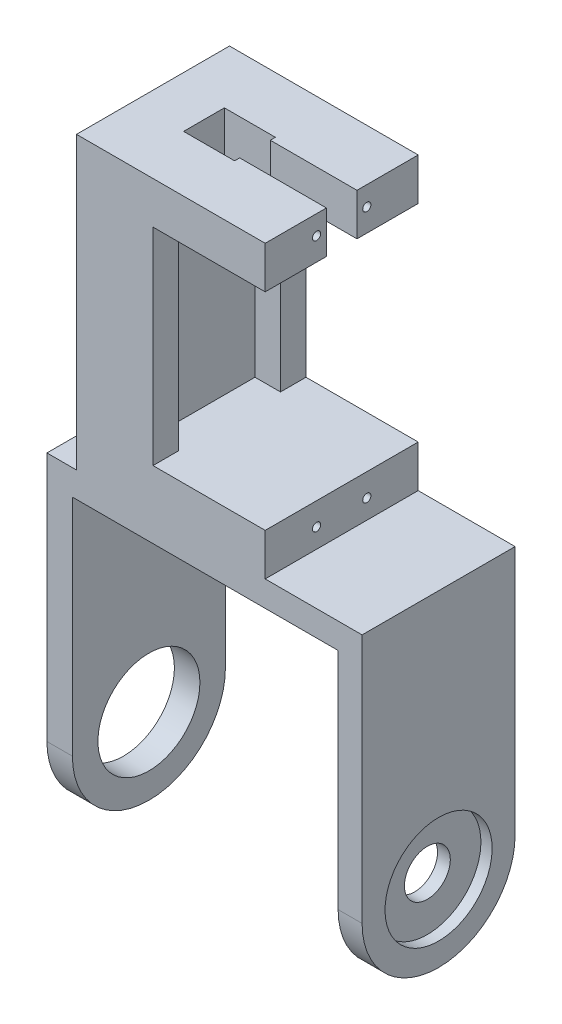
from build123d import *

# Parameters (mm, degrees)
ESQUISSE1_W               = 60.5
ESQUISSE1_H               = 64
BOSS_EXTRU_1_DEPTH        = 30
ESQUISSE2_R               = 4.5
ENL_V_MAT_EXTRU_1_DEPTH   = 32
ENL_V_MAT_EXTRU_2_REACH   = 55.283
ESQUISSE4_W               = 52.1
ESQUISSE4_H               = 83.557669167
ESQUISSE5_R               = 10.5
ENL_V_MAT_EXTRU_3_DEPTH   = 1.7
ESQUISSE6_R               = 10
ENL_V_MAT_EXTRU_4_DEPTH   = 4.2
ESQUISSE7_W               = 47
ESQUISSE7_H               = 57
BOSS_EXTRU_2_DEPTH        = 30
ENL_V_MAT_EXTRU_5_DEPTH   = 30
ENL_V_MAT_EXTRU_6_DEPTH   = 8.25
ESQUISSE11_W              = 5
ESQUISSE11_H              = 40.5
BOSS_EXTRU_3_DEPTH        = 5
ESQUISSE12_R              = 0.5
ENL_V_MAT_EXTRU_7_DEPTH   = 15
TROU_TARAUD_M2X0_42_D     = 1.6
TROU_TARAUD_M2X0_42_DEPTH = 17
TROU_TARAUD_M2X0_42_TIP   = 0.480688495
ENL_V_MAT_EXTRU_8_REACH   = 113.72
TROU_TARAUD_M3X0_54_D     = 2.5
TROU_TARAUD_M3X0_54_DEPTH = 17.5
TROU_TARAUD_M3X0_54_TIP   = 0.751075774
ENL_V_MAT_EXTRU_9_REACH   = 100.671
ESQUISSE26_W              = 5
ESQUISSE26_H              = 64.513244551
BOSS_EXTRU_5_START        = 0.8
BOSS_EXTRU_5_DEPTH        = 0.8
BOSS_EXTRU_6_DEPTH        = 0.5
ESQUISSE30_R              = 10
ENL_V_MAT_EXTRU_10_DEPTH  = 20.5
ENL_V_START               = -20.5
ESQUISSE32_R              = 10.5
ENL_V_MAT_EXTRU_13_DEPTH  = 20.5


with BuildPart() as part:
    # Esquisse1 → Boss.-Extru.1 (new body)
    with BuildSketch(Plane.XY):
        Rectangle(ESQUISSE1_W, ESQUISSE1_H)
    extrude(amount=BOSS_EXTRU_1_DEPTH)

    # Esquisse2 → Enlèv. mat.-Extru.1 (cut)
    with BuildSketch(Plane(origin=(30.25, 0, 0), x_dir=(0, 0, -1), z_dir=(1, 0, 0))):
        with Locations(Location((-15, -17, 0), (0, 0, 90))):
            Circle(ESQUISSE2_R)
    extrude(amount=-ENL_V_MAT_EXTRU_1_DEPTH, mode=Mode.SUBTRACT)

    # Enlèv. mat.-Extru.2: up to this face of the body (flat: up to its plane)
    enl_v_mat_extru_2_end = Plane(part.part.faces().sort_by_distance((0, 0, 0))[0])
    # Esquisse4 → Enlèv. mat.-Extru.2 (cut, up to the picked face)
    with BuildSketch(Plane.XY.offset(30), mode=Mode.PRIVATE) as enl_v_mat_extru_2_sk1:
        with Locations((0, -14.778834584)):
            Rectangle(ESQUISSE4_W, ESQUISSE4_H)
    enl_v_mat_extru_2_tool1 = split(extrude(enl_v_mat_extru_2_sk1.sketch, amount=-ENL_V_MAT_EXTRU_2_REACH, mode=Mode.PRIVATE), bisect_by=enl_v_mat_extru_2_end, keep=Keep.BOTH, mode=Mode.PRIVATE)
    add(enl_v_mat_extru_2_tool1.solids().sort_by(Axis((0, -14.778835, 30), (0, 0, -1)))[0], mode=Mode.SUBTRACT)

    # Esquisse5 → Enlèv. mat.-Extru.3 (cut)
    with BuildSketch(Plane(origin=(30.25, 0, 0), x_dir=(0, 0, -1), z_dir=(1, 0, 0))):
        with Locations(Location((-15, -17, 0), (0, 0, 90))):
            Circle(ESQUISSE5_R)
    extrude(amount=-ENL_V_MAT_EXTRU_3_DEPTH, mode=Mode.SUBTRACT)

    # Esquisse6 → Enlèv. mat.-Extru.4 (cut)
    with BuildSketch(Plane(origin=(-26.05, 0, 0), x_dir=(0, 0, -1), z_dir=(1, 0, 0))):
        with Locations((-15, -17)):
            Circle(ESQUISSE6_R)
    extrude(amount=-ENL_V_MAT_EXTRU_4_DEPTH, mode=Mode.SUBTRACT)

    # Esquisse7 → Boss.-Extru.2 (add)
    with BuildSketch(Plane.XY.offset(30)):
        with Locations((-6.75, 60.5)):
            Rectangle(ESQUISSE7_W, ESQUISSE7_H)
    extrude(amount=-BOSS_EXTRU_2_DEPTH)

    # Esquisse8 → Enlèv. mat.-Extru.5 (cut)
    with BuildSketch(Plane.XY.offset(30)):
        Polygon((-15.25, 80.75), (11.75, 80.75), (11.75, 98.556441221), (21.75, 98.556441221), (21.75, 32), (11.75, 32), (11.75, 40.25), (-15.25, 40.25), align=None)
    extrude(amount=-ENL_V_MAT_EXTRU_5_DEPTH, mode=Mode.SUBTRACT)

    # Esquisse10 → Enlèv. mat.-Extru.6 (cut)
    with BuildSketch(Plane.XZ.offset(-80.75)):
        Polygon((-5.25, 11), (-5.25, 12), (34.75, 12), (34.75, 18), (-5.25, 18), (-5.25, 19), (-15.25, 19), (-15.25, 11), align=None)
    extrude(amount=-ENL_V_MAT_EXTRU_6_DEPTH, mode=Mode.SUBTRACT)

    # Esquisse11 → Boss.-Extru.3 (add)
    with BuildSketch(Plane(origin=(-15.25, 0, 0), x_dir=(0, 0, -1), z_dir=(1, 0, 0))):
        with Locations((-27.5, 60.5)):
            Rectangle(ESQUISSE11_W, ESQUISSE11_H)
        with Locations((-2.5, 60.5)):
            Rectangle(ESQUISSE11_W, ESQUISSE11_H)
    extrude(amount=BOSS_EXTRU_3_DEPTH)

    # Esquisse12 → Enlèv. mat.-Extru.7 (cut)
    with BuildSketch(Plane(origin=(11.75, 0, 0), x_dir=(0, 0, -1), z_dir=(1, 0, 0))):
        with Locations((-19.925, 85.21)):
            Circle(ESQUISSE12_R)
        with Locations(Location((-10.075, 85.21, 0), (0, 0, 180))):
            Circle(ESQUISSE12_R)
        with Locations((-10.075, 35.79)):
            Circle(ESQUISSE12_R)
        with Locations(Location((-19.925, 35.79, 0), (0, 0, 180))):
            Circle(ESQUISSE12_R)
    extrude(amount=-ENL_V_MAT_EXTRU_7_DEPTH, mode=Mode.SUBTRACT)

    # Trou taraudé M2x0.42
    with Locations(Plane(origin=(11.75, 85.21, 19.925), x_dir=(0, 0, 1), z_dir=(1, 0, 0))):
        with Locations((0, 0), (-9.85, 0), (-9.85, 49.42), (0, 49.42)):
            Hole(TROU_TARAUD_M2X0_42_D / 2, depth=TROU_TARAUD_M2X0_42_DEPTH)
            with Locations((0, 0, -(TROU_TARAUD_M2X0_42_DEPTH + TROU_TARAUD_M2X0_42_TIP / 2))):  # 118° drill point
                Cone(0, TROU_TARAUD_M2X0_42_D / 2, TROU_TARAUD_M2X0_42_TIP, mode=Mode.SUBTRACT)

    # Enlèv. mat.-Extru.8: up to this face of the body (flat: up to its plane)
    enl_v_mat_extru_8_end = Plane(part.part.faces().sort_by_distance((30.25, 3.741727612, 15))[0])
    # Esquisse15 → Enlèv. mat.-Extru.8 (cut, up to the picked face)
    with BuildSketch(Plane.ZY.offset(30.25), mode=Mode.PRIVATE) as enl_v_mat_extru_8_sk1:
        with BuildLine():
            Line((40, -17), (30, -17))
            ThreePointArc((30, -17), (15, -32), (0, -17))
            Line((0, -17), (-10, -17))
            ThreePointArc((-10, -17), (15, -42), (40, -17))
        make_face()
    enl_v_mat_extru_8_tool1 = split(extrude(enl_v_mat_extru_8_sk1.sketch, amount=-ENL_V_MAT_EXTRU_8_REACH, mode=Mode.PRIVATE), bisect_by=enl_v_mat_extru_8_end, keep=Keep.BOTH, mode=Mode.PRIVATE)
    add(enl_v_mat_extru_8_tool1.solids().sort_by(Axis((-30.25, -17.559017, -5), (1, 0, 0)))[0], mode=Mode.SUBTRACT)

    # Trou taraudé M3x0.54
    with Locations(Plane(origin=(-30.25, 70.15, 15), x_dir=(0, -1, 0), z_dir=(-1, 0, 0))):
        with Locations((0, 0)):
            Hole(TROU_TARAUD_M3X0_54_D / 2, depth=TROU_TARAUD_M3X0_54_DEPTH)
            with Locations((0, 0, -(TROU_TARAUD_M3X0_54_DEPTH + TROU_TARAUD_M3X0_54_TIP / 2))):  # 118° drill point
                Cone(0, TROU_TARAUD_M3X0_54_D / 2, TROU_TARAUD_M3X0_54_TIP, mode=Mode.SUBTRACT)

    # Enlèv. mat.-Extru.9: up to this face of the body (flat: up to its plane)
    enl_v_mat_extru_9_end = Plane(part.part.faces().sort_by_distance((-10.488138476, 46.757965151, 0))[0])
    # Esquisse26 → Enlèv. mat.-Extru.9 (cut, up to the picked face)
    with BuildSketch(Plane.XY.offset(30), mode=Mode.PRIVATE) as enl_v_mat_extru_9_sk1:
        with Locations((-27.75, 64.256622276)):
            Rectangle(ESQUISSE26_W, ESQUISSE26_H)
    enl_v_mat_extru_9_tool1 = split(extrude(enl_v_mat_extru_9_sk1.sketch, amount=-ENL_V_MAT_EXTRU_9_REACH, mode=Mode.PRIVATE), bisect_by=enl_v_mat_extru_9_end, keep=Keep.BOTH, mode=Mode.PRIVATE)
    add(enl_v_mat_extru_9_tool1.solids().sort_by(Axis((-27.75, 64.256622, 30), (0, 0, -1)))[0], mode=Mode.SUBTRACT)

    # Esquisse27 → Boss.-Extru.5 (add)
    with BuildSketch(Plane.ZY.offset(30.25).offset(BOSS_EXTRU_5_START)):
        with BuildLine():
            Line((30, -17), (30, 32))
            Line((30, 32), (0, 32))
            Line((0, 32), (0, -17))
            ThreePointArc((0, -17), (15, -32), (30, -17))
        make_face()
    extrude(amount=-BOSS_EXTRU_5_DEPTH)

    # Esquisse28 → Boss.-Extru.6 (add)
    with BuildSketch(Plane(origin=(30.25, 0, 0), x_dir=(0, 0, -1), z_dir=(1, 0, 0))):
        with BuildLine():
            Line((-30, 32), (-30, -17))
            ThreePointArc((-30, -17), (-15, -32), (0, -17))
            Line((0, -17), (0, 32))
            Line((0, 32), (-30, 32))
        make_face()
    extrude(amount=BOSS_EXTRU_6_DEPTH)

    # Esquisse30 → Enlèv. mat.-Extru.10 (cut)
    with BuildSketch(Plane(origin=(-30.25, 0, 0), x_dir=(0, 0, -1), z_dir=(1, 0, 0))):
        with Locations((-15, -17)):
            Circle(ESQUISSE30_R)
    extrude(amount=-ENL_V_MAT_EXTRU_10_DEPTH, mode=Mode.SUBTRACT)

    # Esquisse32 → Enlèv. mat.-Extru.13 (cut)
    with BuildSketch(Plane.ZY.offset(-30.25).offset(ENL_V_START)):
        with Locations(Location((15, -17, 0), (0, 0, 90))):
            Circle(ESQUISSE32_R)
    extrude(amount=ENL_V_MAT_EXTRU_13_DEPTH, mode=Mode.SUBTRACT)


solid = part.part
